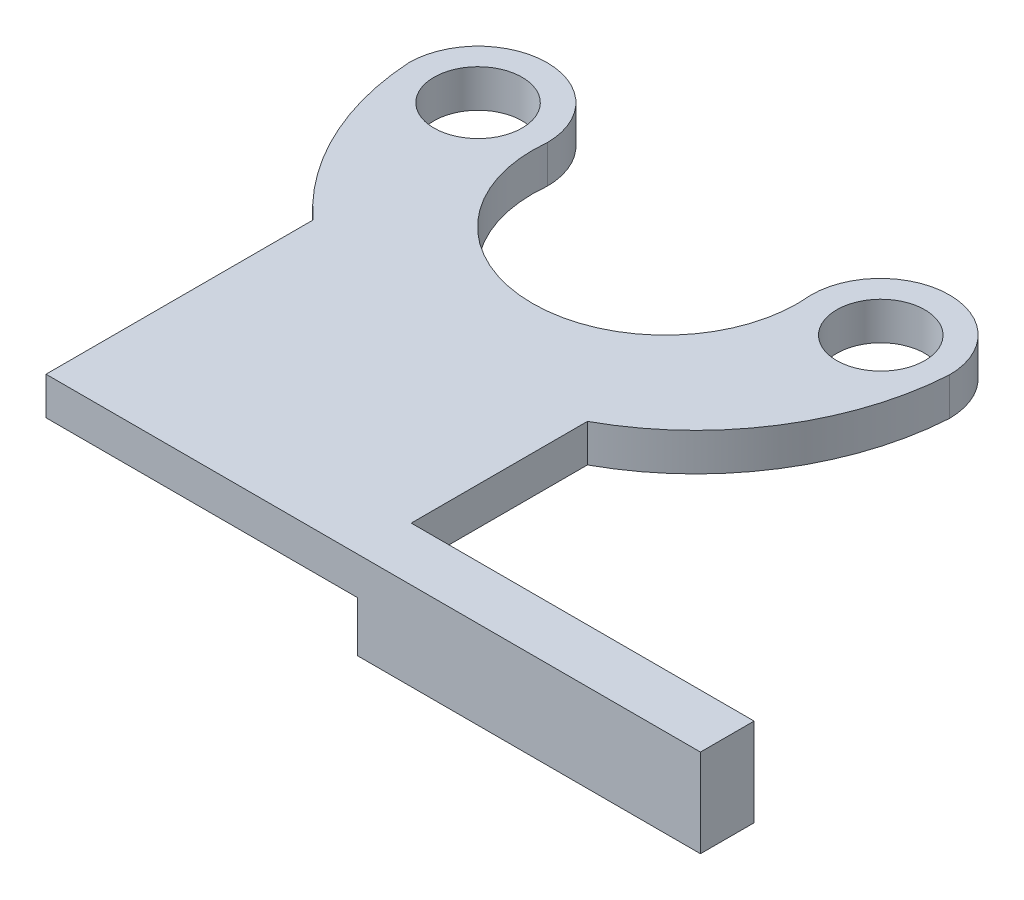
from build123d import *

# Parameters (mm, degrees)
SKETCH_1_R      = 1.75
EXTRUDE_1_DEPTH = 1.5
SKETCH_2_W      = 13.622112507
SKETCH_2_H      = 2.131934571
EXTRUDE_2_DEPTH = 3.5


with BuildPart() as part:
    # 草图1 → 凸台-拉伸1 (new body)
    with BuildSketch(Plane(origin=(0, 0, 0), x_dir=(1, 0, 0), z_dir=(0, 1, 0))):
        with BuildLine():
            Line((-7.23910046, -7.314129875), (-7.23910046, -17.924733935))
            Line((-7.23910046, -17.924733935), (18.76089954, -17.924733935))
            Line((18.76089954, -17.924733935), (18.76089954, -15.792799364))
            Line((18.76089954, -15.792799364), (5.138787033, -15.792799364))
            Line((5.138787033, -15.792799364), (5.138787033, -8.792799364))
            ThreePointArc((5.138787033, -8.792799364), (9.069997492, -5.118417293), (10.730510575, 0))
            ThreePointArc((10.730510575, 0), (7.980510575, 2.75), (5.230510575, 0))
            ThreePointArc((5.230510575, 0), (-0.009744712, -5.827408606), (-5.25, 0))
            ThreePointArc((-5.25, 0), (-8, 2.75), (-10.75, 0))
            ThreePointArc((-10.75, 0), (-9.710304188, -4.000638307), (-7.23910046, -7.314129875))
        make_face()
        with Locations(Location((-8, 0, 0), (0, 0, 270))):
            Circle(SKETCH_1_R, mode=Mode.SUBTRACT)
        with Locations(Location((8, 0, 0), (0, 0, 270))):
            Circle(SKETCH_1_R, mode=Mode.SUBTRACT)
    extrude(amount=EXTRUDE_1_DEPTH)

    # 草图2 → 凸台-拉伸2 (add)
    with BuildSketch(Plane(origin=(0, 1.5, 0), x_dir=(1, 0, 0), z_dir=(0, 1, 0))):
        with Locations((11.949843287, -16.85876665)):
            Rectangle(SKETCH_2_W, SKETCH_2_H)
    extrude(amount=-EXTRUDE_2_DEPTH)


solid = part.part
